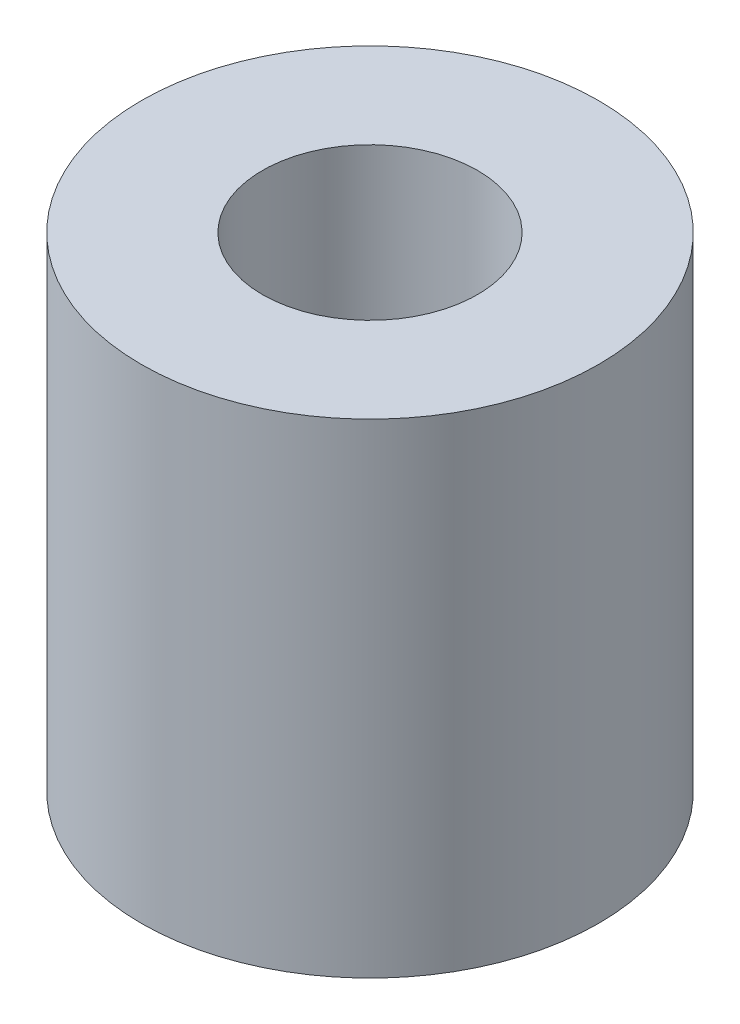
from build123d import *

# Parameters (mm, degrees)
SKETCH1_R           = 5.3975
SKETCH1_R_2         = 2.54
BOSS_EXTRUDE1_DEPTH = 11.43


with BuildPart() as part:
    # Sketch1 → Boss-Extrude1 (new body)
    with BuildSketch(Plane(origin=(0, 0, 0), x_dir=(1, 0, 0), z_dir=(0, 1, 0))):
        with Locations(Location((0, 0, 0), (0, 0, 270))):
            Circle(SKETCH1_R)
        with Locations(Location((0, 0, 0), (0, 0, 270))):
            Circle(SKETCH1_R_2, mode=Mode.SUBTRACT)
    extrude(amount=BOSS_EXTRUDE1_DEPTH)


solid = part.part
